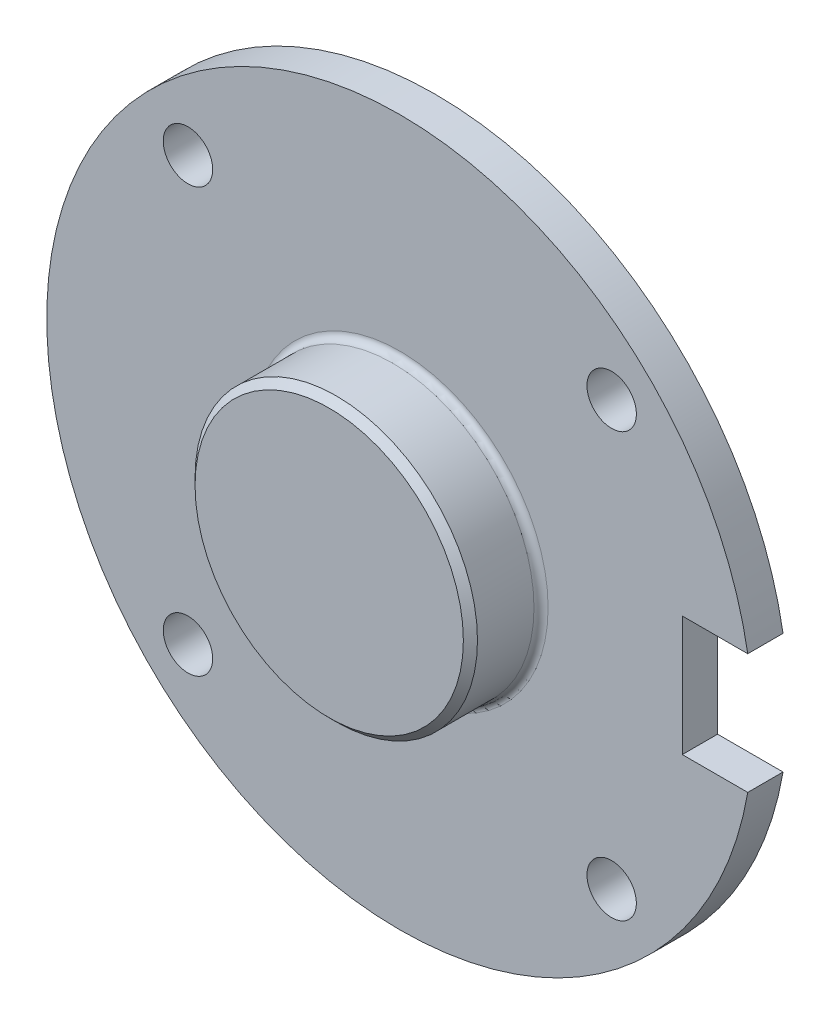
from build123d import *

# Parameters (mm, degrees)
SKETCH5_W         = 10
SKETCH5_H         = 17
EXTRUDE2_DEPTH    = 72.414284285
CIRPATTERN1_COUNT = 4


with BuildPart() as part:
    # Sketch1 → Revolve1 (revolve)
    with BuildSketch(Plane(origin=(0, 0, 0), x_dir=(0, 0, -1), z_dir=(1, 0, 0)), mode=Mode.PRIVATE) as revolve1_sk:
        with BuildLine():
            Line((0, 0), (-15, 0))
            Line((-15, 0), (-15, 19))
            Line((-15, 19), (-14, 20))
            Line((-14, 20), (-6, 20))
            ThreePointArc((-6, 20), (-5.292893219, 20.292893219), (-5, 21))
            Line((-5, 21), (-5, 50))
            Line((-5, 50), (0, 50))
            Line((0, 50), (0, 0))
        make_face()
    revolve(revolve1_sk.sketch.rotate(Axis((0, 0, 50), (0, 0, -1)), 90), axis=Axis((0, 0, 50), (0, 0, -1)))

    # Sketch5 → Extrude2 (cut, through all)
    with BuildSketch(Plane.XY.offset(5)):
        with Locations((45, 0)):
            Rectangle(SKETCH5_W, SKETCH5_H)
    extrude(amount=-EXTRUDE2_DEPTH, mode=Mode.SUBTRACT)

    # Sketch6 → Ø7.0 (7) Diameter Hole1 (revolve, cut)
    with BuildSketch(Plane(origin=(-30, 30, 5), x_dir=(0, -1, 0), z_dir=(1, 0, 0))):
        Polygon((0, 0), (0, 12.103012167), (3.5, 10), (3.5, 0), align=None)
    f_7_0_7_diameter_hole1 = revolve(axis=Axis((-30, 30, 11.35), (0, 0, -1)), mode=Mode.SUBTRACT)

    # CirPattern1: Ø7.0 (7) Diameter Hole1 ×4 about axis
    cirpattern1_axis = Axis((0, 0, 0), (0, 0, 1))
    for i in range(1, CIRPATTERN1_COUNT):
        add(f_7_0_7_diameter_hole1.rotate(cirpattern1_axis, i * 360 / CIRPATTERN1_COUNT), mode=Mode.SUBTRACT)


solid = part.part
